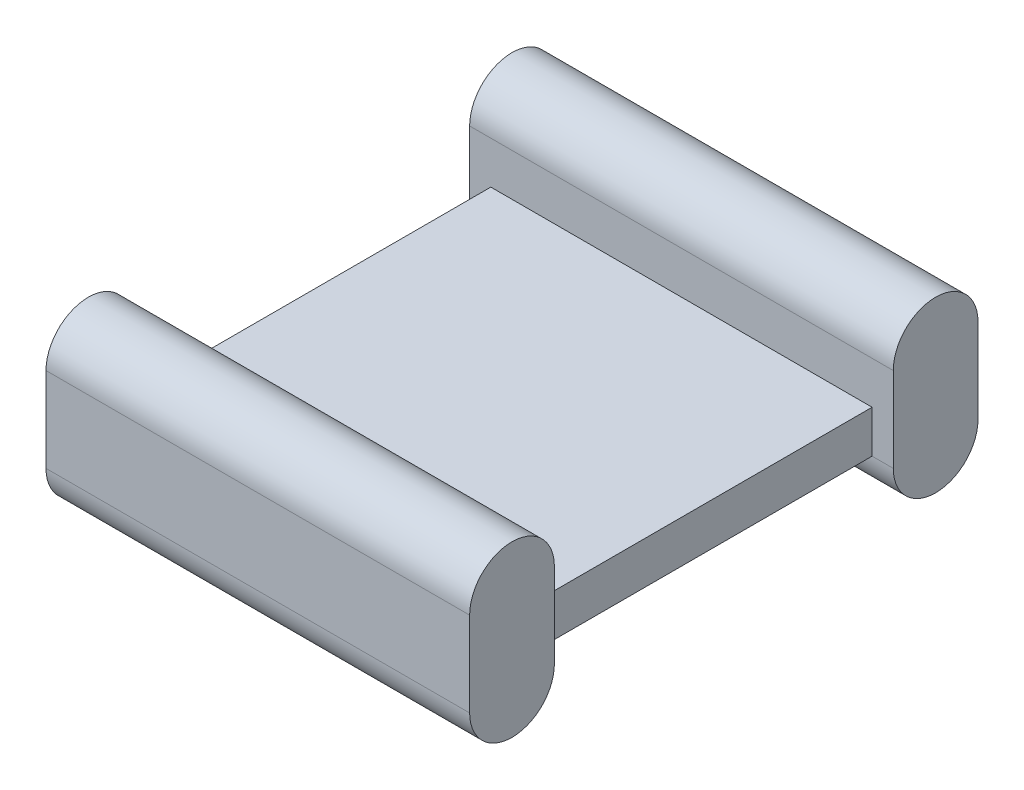
from build123d import *

# Parameters (mm, degrees)
SKETCH1_W           = 228.6
SKETCH1_H           = 304.8
BOSS_EXTRUDE1_DEPTH = 12.7
BOSS_EXTRUDE2_DEPTH = 127


with BuildPart() as part:
    # Sketch1 → Boss-Extrude1 (new, symmetric)
    with BuildSketch(Plane(origin=(0, 0, 0), x_dir=(1, 0, 0), z_dir=(0, 1, 0))):
        Rectangle(SKETCH1_W, SKETCH1_H)
    extrude(amount=BOSS_EXTRUDE1_DEPTH, both=True)

    # Sketch2 → Boss-Extrude2 (add, symmetric)
    with BuildSketch(Plane(origin=(0, 0, 0), x_dir=(0, 0, -1), z_dir=(1, 0, 0))):
        with BuildLine():
            Line((-152.4, -12.7), (-152.4, 38.1))
            ThreePointArc((-152.4, 38.1), (-127, 63.5), (-101.6, 38.1))
            Line((-101.6, 38.1), (-101.6, -12.7))
            ThreePointArc((-101.6, -12.7), (-127, -38.1), (-152.4, -12.7))
        make_face()
        with BuildLine():
            Line((101.6, -12.7), (101.6, 38.1))
            ThreePointArc((101.6, 38.1), (127, 63.5), (152.4, 38.1))
            Line((152.4, 38.1), (152.4, -12.7))
            ThreePointArc((152.4, -12.7), (127, -38.1), (101.6, -12.7))
        make_face()
    extrude(amount=BOSS_EXTRUDE2_DEPTH, both=True)


solid = part.part
